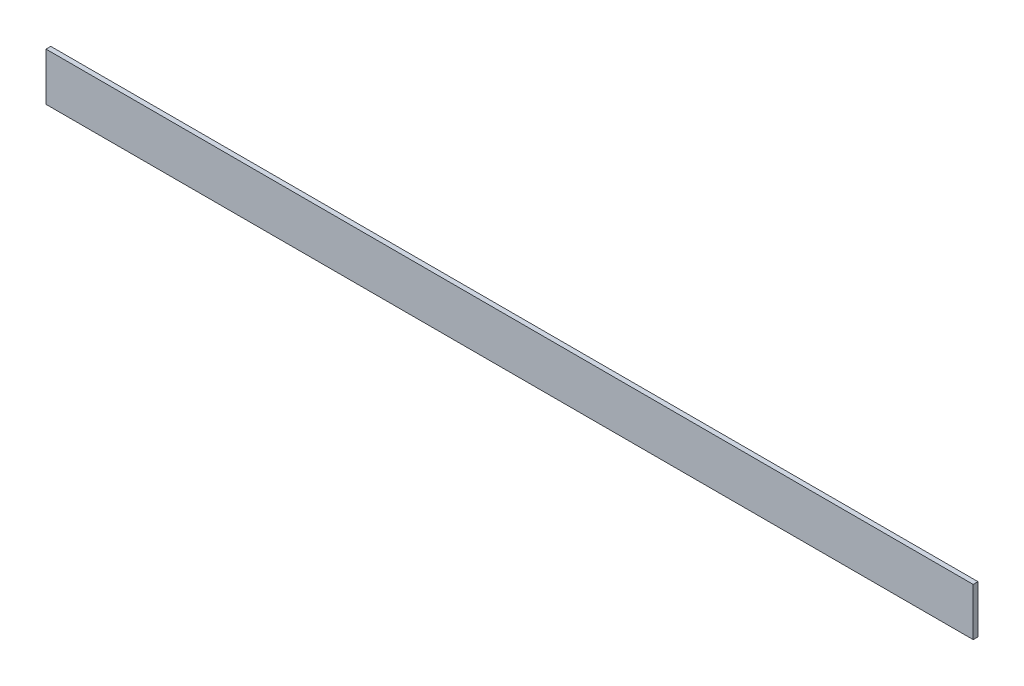
from build123d import *

# Parameters (mm, degrees)
SKETCH1_W           = 1938
SKETCH1_H           = 100
BOSS_EXTRUDE1_DEPTH = 10


with BuildPart() as part:
    # Sketch1 → Boss-Extrude1 (new body)
    with BuildSketch(Plane.XY):
        Rectangle(SKETCH1_W, SKETCH1_H)
    extrude(amount=BOSS_EXTRUDE1_DEPTH)


solid = part.part
